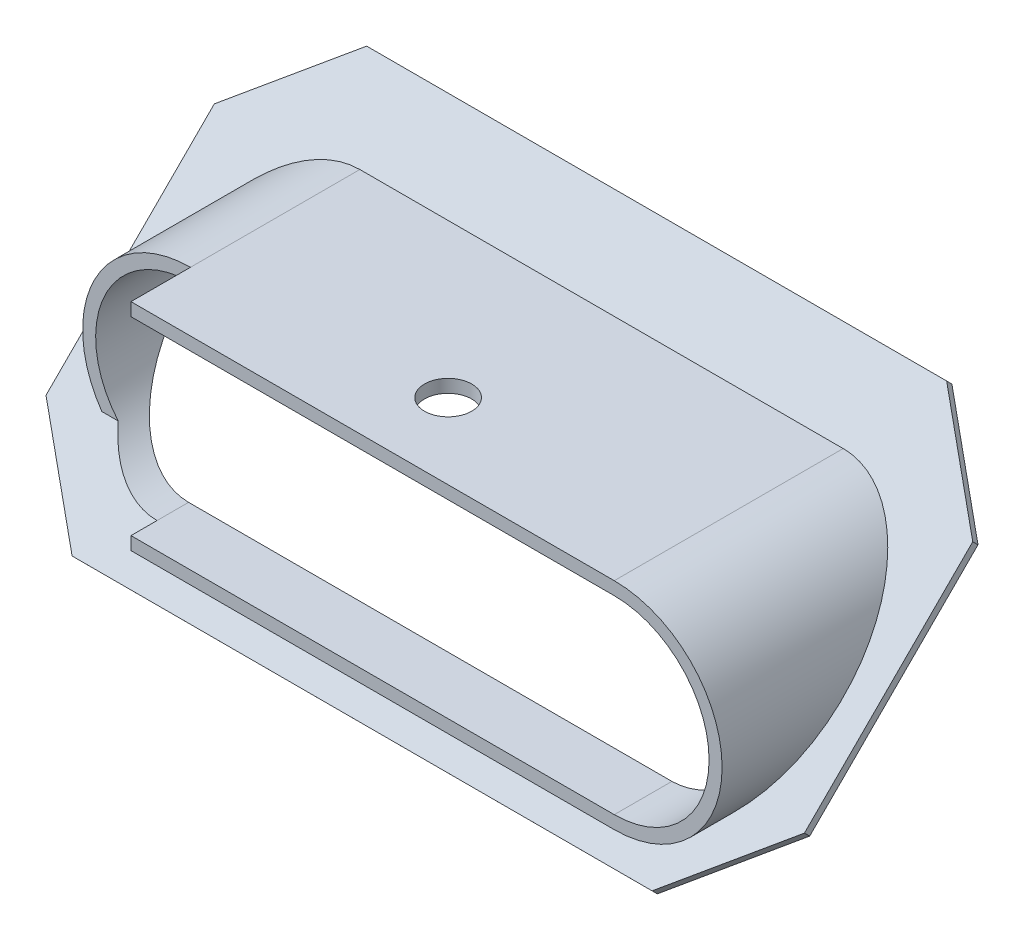
from build123d import *

# Parameters (mm, degrees)
BOSS_EXTRUDE12_DEPTH            = 80
CUT_EXTRUDE10_DEPTH             = 114.712356409
CUT_EXTRUDE10_DEPTH_BACK        = 114.712356409
SKETCH37_W                      = 102
SKETCH37_H                      = 56
BOSS_EXTRUDE16_DEPTH            = 3
CUT_EXTRUDE11_DEPTH             = 102.766059637
SKETCH40_W                      = 127.486838651
SKETCH40_H                      = 54.833163407
CUT_EXTRUDE12_DEPTH             = 102.007241851
CUT_EXTRUDE12_DIRECTION_2_REACH = 103.007
CUT_EXTRUDE14_DEPTH             = 18.5
F_1_4_0_25_DIAMETER_HOLE1_D     = 6.35
F_1_4_0_25_DIAMETER_HOLE1_DEPTH = 5
F_1_4_0_25_DIAMETER_HOLE1_TIP   = 1.907732465
CHAMFER2_SIZE                   = 12
CHAMFER3_SIZE                   = 2


with BuildPart() as part:
    # Sketch22 → Boss-Extrude12 (new body)
    with BuildSketch(Plane.XY):
        with BuildLine():
            Line((32.5, -14.5), (-32.5, -14.5))
            ThreePointArc((-32.5, -14.5), (-47, 0), (-32.5, 14.5))
            Line((-32.5, 14.5), (32.5, 14.5))
            ThreePointArc((32.5, 14.5), (47, 0), (32.5, -14.5))
        make_face()
    extrude(amount=BOSS_EXTRUDE12_DEPTH)

    # Sketch35 → Cut-Extrude10 (cut, two sides: drawn at the far end of the back side and taken through both)
    with BuildSketch(Plane(origin=(-32.5, 0, 0), x_dir=(0, 0, -1), z_dir=(1, 0, 0)).offset(-CUT_EXTRUDE10_DEPTH_BACK)):
        Polygon((0, 14.5), (-29.026860374, -14.5), (0, -14.5), align=None)
    extrude(amount=CUT_EXTRUDE10_DEPTH + CUT_EXTRUDE10_DEPTH_BACK, mode=Mode.SUBTRACT)

    # Sketch37 → Boss-Extrude16 (add)
    with BuildSketch(Plane(origin=(0, 7.256711984, 7.249996893), x_dir=(-1, 0, 0), z_dir=(0, -0.7074340219640284, -0.7067793888957138))):
        with Locations((0, -10.26729429)):
            Rectangle(SKETCH37_W, SKETCH37_H)
    extrude(amount=-BOSS_EXTRUDE16_DEPTH)

    # Sketch38 → Cut-Extrude11 (cut, through all)
    with BuildSketch(Plane.XY.offset(80)):
        with BuildLine():
            Line((-32.5, 12.75), (32.5, 12.75))
            ThreePointArc((32.5, 12.75), (45.25, 0), (32.5, -12.75))
            Line((32.5, -12.75), (-32.5, -12.75))
            ThreePointArc((-32.5, -12.75), (-45.25, 0), (-32.5, 12.75))
        make_face()
    extrude(amount=-CUT_EXTRUDE11_DEPTH, mode=Mode.SUBTRACT)

    # Sketch40 → Cut-Extrude12 (cut)
    with BuildSketch(Plane(origin=(0, -12.75, 0), x_dir=(1, 0, 0), z_dir=(0, 1, 0))):
        with Locations((5.984726224, -62.441589639)):
            Rectangle(SKETCH40_W, SKETCH40_H)
    extrude(amount=CUT_EXTRUDE12_DEPTH, mode=Mode.SUBTRACT)

    # Cut-Extrude12 direction 2: up to this face of the body (flat: up to its plane)
    cut_extrude12_direction_2_end = Plane(part.part.faces().sort_by_distance((0, -14.5, 56.635733163))[0])
    # Sketch40 → Cut-Extrude12 direction 2 (cut, up to the picked face)
    with BuildSketch(Plane(origin=(0, -12.75, 0), x_dir=(1, 0, 0), z_dir=(0, 1, 0)), mode=Mode.PRIVATE) as cut_extrude12_direction_2_sk1:
        with Locations((5.984726224, -62.441589639)):
            Rectangle(SKETCH40_W, SKETCH40_H)
    cut_extrude12_direction_2_tool1 = split(extrude(cut_extrude12_direction_2_sk1.sketch, amount=-CUT_EXTRUDE12_DIRECTION_2_REACH, mode=Mode.PRIVATE), bisect_by=cut_extrude12_direction_2_end, keep=Keep.BOTH, mode=Mode.PRIVATE)
    add(cut_extrude12_direction_2_tool1.solids().sort_by(Axis((5.984726, -12.75, 62.44159), (0, -1, 0)))[0], mode=Mode.SUBTRACT)

    # Sketch42 → Cut-Extrude14 (cut)
    with BuildSketch(Plane.ZY.offset(51)):
        Polygon((35.025007935, 14.5), (27.025007935, 14.5), (27.025007935, -8.259321849), (33.271466325, -14.5), (35.025007935, -14.5), align=None)
    extrude(amount=-CUT_EXTRUDE14_DEPTH, mode=Mode.SUBTRACT)

    # 1/4 (0.25) Diameter Hole1
    with Locations(Plane(origin=(0, 14.5, 0), x_dir=(1, 0, 0), z_dir=(0, 1, 0))):
        with Locations((2.6293e-05, -24.875007935)):
            Hole(F_1_4_0_25_DIAMETER_HOLE1_D / 2, depth=F_1_4_0_25_DIAMETER_HOLE1_DEPTH)
            with Locations((0, 0, -(F_1_4_0_25_DIAMETER_HOLE1_DEPTH + F_1_4_0_25_DIAMETER_HOLE1_TIP / 2))):  # 118° drill point
                Cone(0, F_1_4_0_25_DIAMETER_HOLE1_D / 2, F_1_4_0_25_DIAMETER_HOLE1_TIP, mode=Mode.SUBTRACT)

    # Chamfer2
    chamfer2_edges = [part.edges().sort_by_distance(p)[0] for p in [
        (51, -18.728671856, 35.381751886),
        (51, 20.850973922, -4.234553344),
        (-51, 20.850973922, -4.234553344),
        (-51, -18.728671856, 35.381751886),
    ]]
    chamfer(chamfer2_edges, length=CHAMFER2_SIZE)

    # Chamfer3
    chamfer3_edges = [part.edges().sort_by_distance(p)[0] for p in [
        (-51, 0, 14.513430187),
        (51, 0, 14.513430187),
        (0, -19.789822889, 34.321582802),
        (0, 19.789822889, -5.294722428),
        (-45, -15.549146556, 30.07697867),
        (45, -15.549146556, 30.07697867),
        (45, 15.549146556, -1.050118296),
        (-45, 15.549146556, -1.050118296),
    ]]
    chamfer(chamfer3_edges, length=CHAMFER3_SIZE)


solid = part.part
